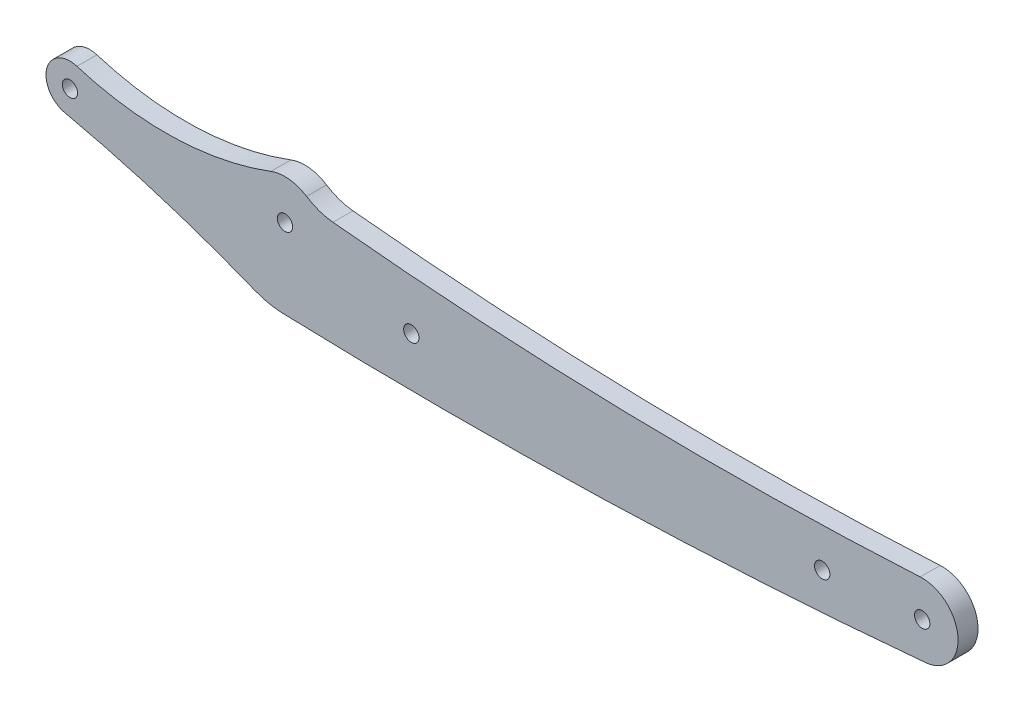
from build123d import *

# Parameters (mm, degrees)
ESQUISSE1_R        = 1.925
BOSS_EXTRU_1_DEPTH = 5


with BuildPart() as part:
    # Esquisse1 → Boss.-Extru.1 (new body)
    with BuildSketch(Plane.XY):
        with BuildLine():
            ThreePointArc((-55.827782292, -14.46282996), (24.922748014, -14.598984118), (105.525948354, -9.721405027))
            ThreePointArc((105.525948354, -9.721405027), (113.679539111, -0.101767596), (104.211594017, 8.227487007))
            ThreePointArc((104.211594017, 8.227487007), (30.47680307, 7.057280789), (-43.126605449, 11.609975917))
            ThreePointArc((-43.126605449, 11.609975917), (-46.576807991, 12.376745737), (-49.75182207, 13.929523614))
            ThreePointArc((-49.75182207, 13.929523614), (-54.116731069, 15.47051298), (-58.707950184, 14.880779279))
            ThreePointArc((-58.707950184, 14.880779279), (-82.908915105, 10.07391595), (-107.360082719, 13.380430803))
            ThreePointArc((-107.360082719, 13.380430803), (-114.932002243, 9.181129893), (-110.424129779, 1.788756847))
            ThreePointArc((-110.424129779, 1.788756847), (-86.236289716, -4.6172752), (-62.66641753, -13.016678668))
            ThreePointArc((-62.66641753, -13.016678668), (-59.310767285, -14.040827891), (-55.827782292, -14.46282996))
        make_face()
        with Locations((-23.472610973, -2.725250912)):
            Circle(ESQUISSE1_R, mode=Mode.SUBTRACT)
        with Locations((79.612874717, -2.574784989)):
            Circle(ESQUISSE1_R, mode=Mode.SUBTRACT)
        with Locations((-109.131234319, 7.647802958)):
            Circle(ESQUISSE1_R, mode=Mode.SUBTRACT)
        with Locations((-55.172918512, 5.526446001)):
            Circle(ESQUISSE1_R, mode=Mode.SUBTRACT)
        with Locations((104.703572766, -0.759056094)):
            Circle(ESQUISSE1_R, mode=Mode.SUBTRACT)
    extrude(amount=BOSS_EXTRU_1_DEPTH)


solid = part.part
